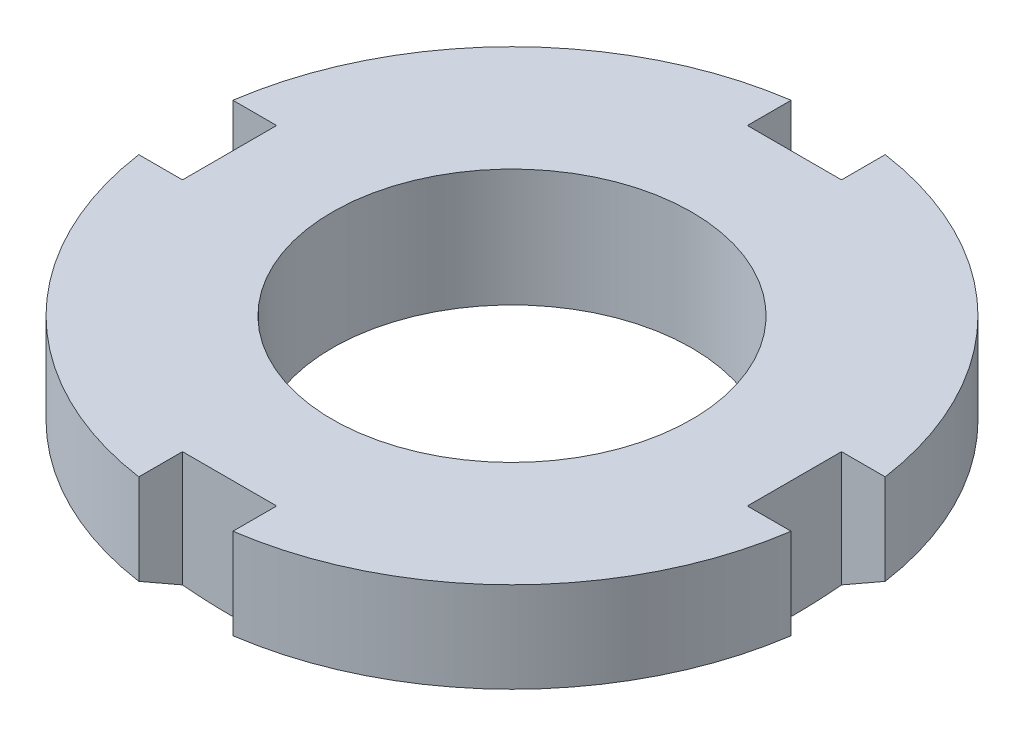
from build123d import *

# Parameters (mm, degrees)
ESQUISSE2_W    = 4
ESQUISSE2_H    = 2
ESQUISSE2_W_2  = 2
ESQUISSE2_H_2  = 4
ENCOCHES_DEPTH = 24.34523506


with BuildPart() as part:
    # Esquisse1 → Base (revolve)
    with BuildSketch(Plane.XY, mode=Mode.PRIVATE) as base_sk:
        Polygon((7.633974596, 5), (14, 5), (14, 1.154700538), (12, 0), (7.633974596, 0), align=None)
    revolve(base_sk.sketch.rotate(Axis((0, 0, 0), (0, 1, 0)), 90), axis=Axis((0, 0, 0), (0, 1, 0)))

    # Esquisse2 → Encoches (cut, through all)
    with BuildSketch(Plane(origin=(0, 5, -4), x_dir=(1, 0, 0), z_dir=(0, -1, 0))):
        with Locations((0, -9)):
            Rectangle(ESQUISSE2_W, ESQUISSE2_H)
        with Locations((0, 17)):
            Rectangle(ESQUISSE2_W, ESQUISSE2_H)
        with Locations((13, 4)):
            Rectangle(ESQUISSE2_W_2, ESQUISSE2_H_2)
        with Locations((-13, 4)):
            Rectangle(ESQUISSE2_W_2, ESQUISSE2_H_2)
    extrude(amount=ENCOCHES_DEPTH, mode=Mode.SUBTRACT)


solid = part.part
